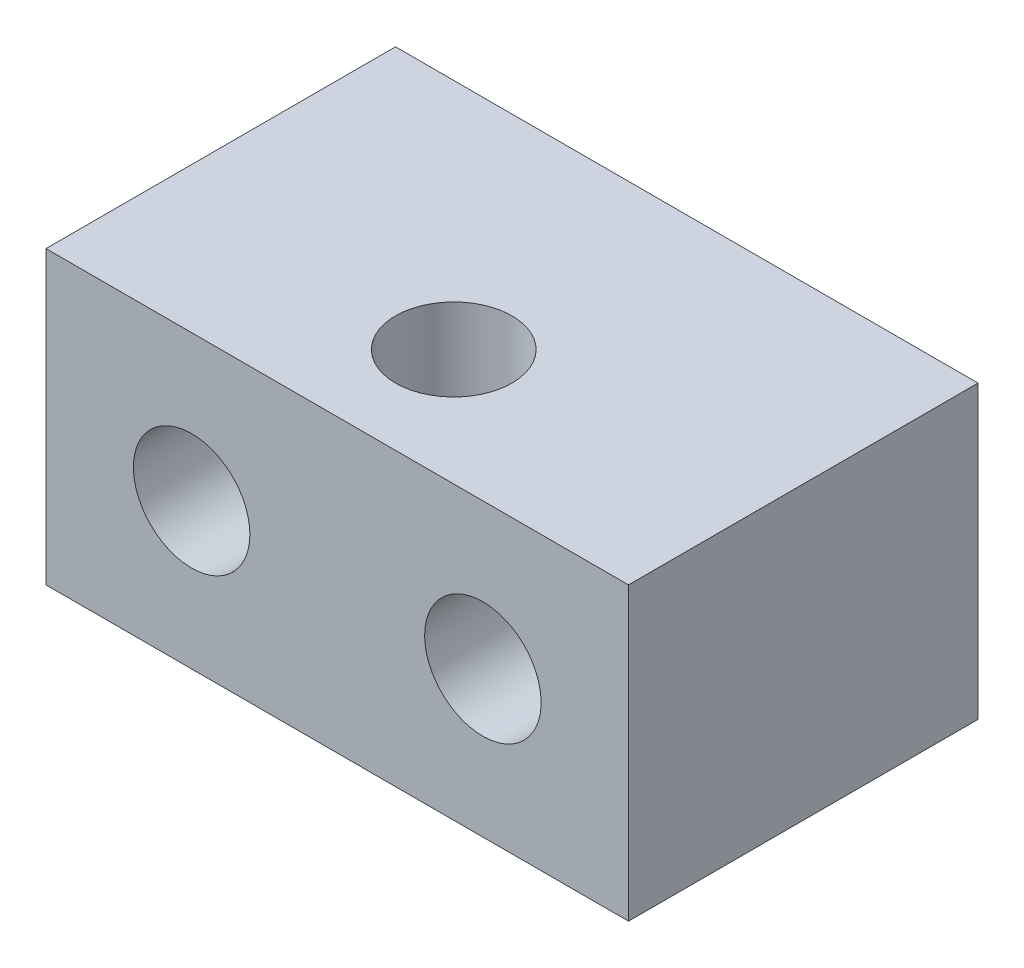
from build123d import *

# Parameters (mm, degrees)
SKETCH_1_W               = 20
SKETCH_1_H               = 12
SKETCH_1_R               = 2
EXTRUDE_1_DEPTH          = 5
CUT_EXTRUDE_1_DEPTH      = 13.68857754
CUT_EXTRUDE_1_DEPTH_BACK = 13.68857754
SKETCH_2_R               = 2


with BuildPart() as part:
    # 草图1 → 凸台-拉伸1 (new, symmetric)
    with BuildSketch(Plane(origin=(0, 0, 0), x_dir=(1, 0, 0), z_dir=(0, 1, 0))):
        Rectangle(SKETCH_1_W, SKETCH_1_H)
        with Locations(Location((0, -2, 0), (0, 0, 270))):
            Circle(SKETCH_1_R, mode=Mode.SUBTRACT)
    extrude(amount=EXTRUDE_1_DEPTH, both=True)

    # 草图2 → 切除-拉伸1 (cut, two sides: drawn at the far end of the back side and taken through both)
    with BuildSketch(Plane.XY.offset(-CUT_EXTRUDE_1_DEPTH_BACK)):
        with Locations((-5, 0)):
            Circle(SKETCH_2_R)
        with Locations(Location((5, 0, 0), (0, 0, 180))):
            Circle(SKETCH_2_R)
    extrude(amount=CUT_EXTRUDE_1_DEPTH + CUT_EXTRUDE_1_DEPTH_BACK, mode=Mode.SUBTRACT)


solid = part.part
